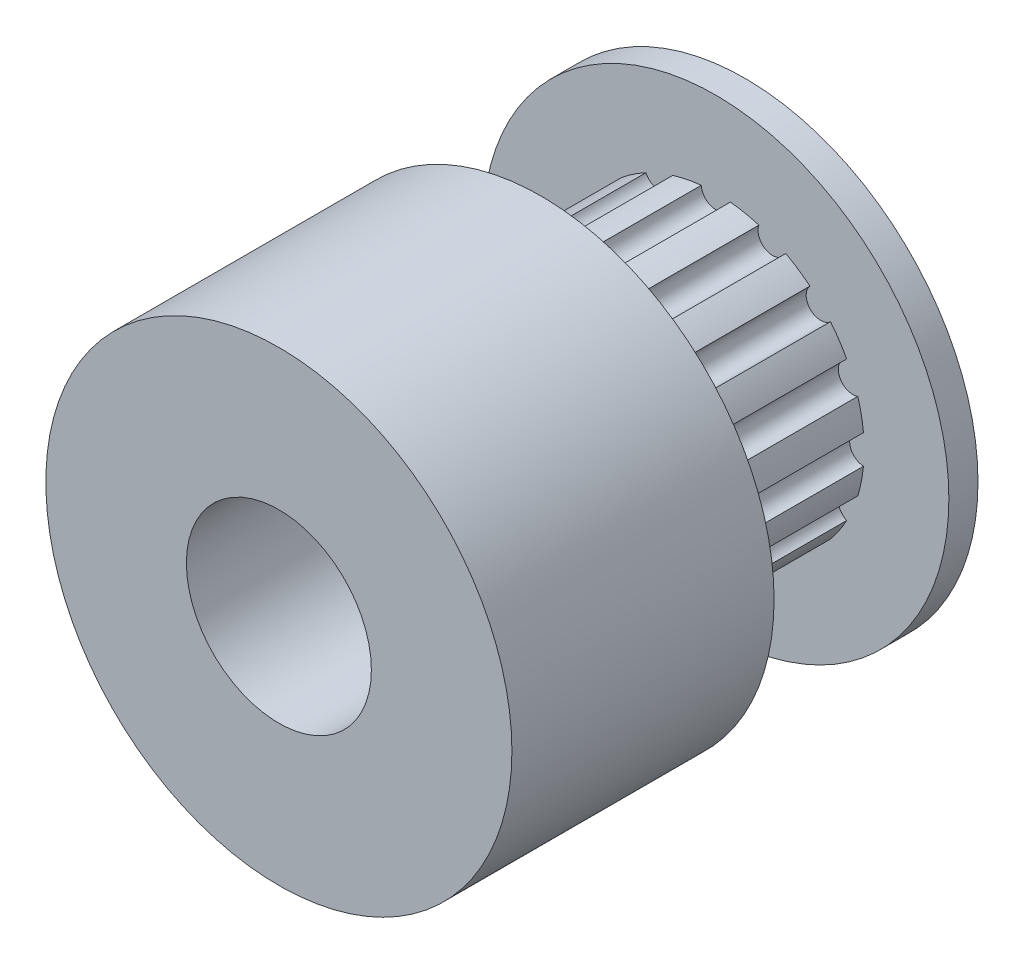
from build123d import *

# Parameters (mm, degrees)
SKETCH1_R           = 8
BOSS_EXTRUDE1_DEPTH = 1
BOSS_EXTRUDE2_DEPTH = 6
SKETCH3_R           = 8
BOSS_EXTRUDE3_DEPTH = 9
SKETCH1_3_R         = 3.175
CUT_EXTRUDE1_DEPTH  = 20.595917942


with BuildPart() as part:
    # Sketch1 → Boss-Extrude1 (new body)
    with BuildSketch(Plane.XY):
        Circle(SKETCH1_R)
    extrude(amount=BOSS_EXTRUDE1_DEPTH)

    # Sketch2 → Boss-Extrude2 (add)
    with BuildSketch(Plane.XY.offset(1)):
        with BuildLine():
            ThreePointArc((-0.499397244, 5.068414486), (-0.993586851, 4.995098416), (-1.47821536, 4.873715458))
            ThreePointArc((-1.47821536, 4.873715458), (-1.757649001, 4.243340055), (-2.400981144, 4.491493355))
            ThreePointArc((-2.400981144, 4.491493355), (-2.829495962, 4.234639963), (-3.230783076, 3.937037431))
            ThreePointArc((-3.230783076, 3.937037431), (-3.247711874, 3.247711874), (-3.937037431, 3.230783076))
            ThreePointArc((-3.937037431, 3.230783076), (-4.234639963, 2.829495962), (-4.491493355, 2.400981144))
            ThreePointArc((-4.491493355, 2.400981144), (-4.243340055, 1.757649001), (-4.873715458, 1.47821536))
            ThreePointArc((-4.873715458, 1.47821536), (-4.995098416, 0.993586851), (-5.068414486, 0.499397244))
            ThreePointArc((-5.068414486, 0.499397244), (-4.592958179, 0), (-5.068414486, -0.499397244))
            ThreePointArc((-5.068414486, -0.499397244), (-4.995098416, -0.993586851), (-4.873715458, -1.47821536))
            ThreePointArc((-4.873715458, -1.47821536), (-4.243340055, -1.757649001), (-4.491493355, -2.400981144))
            ThreePointArc((-4.491493355, -2.400981144), (-4.234639963, -2.829495962), (-3.937037431, -3.230783076))
            ThreePointArc((-3.937037431, -3.230783076), (-3.247711874, -3.247711874), (-3.230783076, -3.937037431))
            ThreePointArc((-3.230783076, -3.937037431), (-2.829495962, -4.234639963), (-2.400981144, -4.491493355))
            ThreePointArc((-2.400981144, -4.491493355), (-1.757649001, -4.243340055), (-1.47821536, -4.873715458))
            ThreePointArc((-1.47821536, -4.873715458), (-0.993586851, -4.995098416), (-0.499397244, -5.068414486))
            ThreePointArc((-0.499397244, -5.068414486), (0, -4.592958179), (0.499397244, -5.068414486))
            ThreePointArc((0.499397244, -5.068414486), (0.993586851, -4.995098416), (1.47821536, -4.873715458))
            ThreePointArc((1.47821536, -4.873715458), (1.757649001, -4.243340055), (2.400981144, -4.491493355))
            ThreePointArc((2.400981144, -4.491493355), (2.829495962, -4.234639963), (3.230783076, -3.937037431))
            ThreePointArc((3.230783076, -3.937037431), (3.247711874, -3.247711874), (3.937037431, -3.230783076))
            ThreePointArc((3.937037431, -3.230783076), (4.234639963, -2.829495962), (4.491493355, -2.400981144))
            ThreePointArc((4.491493355, -2.400981144), (4.243340055, -1.757649001), (4.873715458, -1.47821536))
            ThreePointArc((4.873715458, -1.47821536), (4.995098416, -0.993586851), (5.068414486, -0.499397244))
            ThreePointArc((5.068414486, -0.499397244), (4.592958179, 0), (5.068414486, 0.499397244))
            ThreePointArc((5.068414486, 0.499397244), (4.995098416, 0.993586851), (4.873715458, 1.47821536))
            ThreePointArc((4.873715458, 1.47821536), (4.243340055, 1.757649001), (4.491493355, 2.400981144))
            ThreePointArc((4.491493355, 2.400981144), (4.234639963, 2.829495962), (3.937037431, 3.230783076))
            ThreePointArc((3.937037431, 3.230783076), (3.247711874, 3.247711874), (3.230783076, 3.937037431))
            ThreePointArc((3.230783076, 3.937037431), (2.829495962, 4.234639963), (2.400981144, 4.491493355))
            ThreePointArc((2.400981144, 4.491493355), (1.757649001, 4.243340055), (1.47821536, 4.873715458))
            ThreePointArc((1.47821536, 4.873715458), (0.993586851, 4.995098416), (0.499397244, 5.068414486))
            ThreePointArc((0.499397244, 5.068414486), (0, 4.592958179), (-0.499397244, 5.068414486))
        make_face()
    extrude(amount=BOSS_EXTRUDE2_DEPTH)

    # Sketch3 → Boss-Extrude3 (add)
    with BuildSketch(Plane.XY.offset(7)):
        Circle(SKETCH3_R)
    extrude(amount=BOSS_EXTRUDE3_DEPTH)

    # Sketch1<3> → Cut-Extrude1 (cut, through all)
    with BuildSketch(Plane.XY):
        Circle(SKETCH1_3_R)
    extrude(amount=CUT_EXTRUDE1_DEPTH, mode=Mode.SUBTRACT)


solid = part.part
